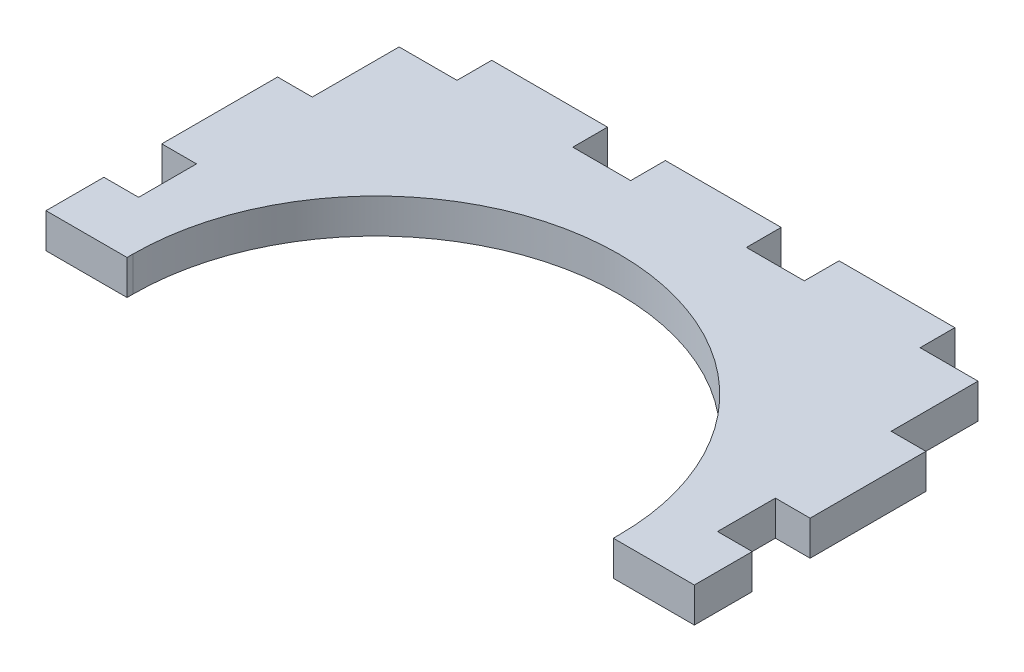
from build123d import *

# Parameters (mm, degrees)
EXTRUDE_1_DEPTH = 3


with BuildPart() as part:
    # 草图2 → 凸台-拉伸1 (new body)
    with BuildSketch(Plane(origin=(0, 0, 0), x_dir=(1, 0, 0), z_dir=(0, 1, 0))):
        with BuildLine():
            Line((-25, 27.5), (-20, 27.5))
            Line((-20, 27.5), (-20, 30.5))
            Line((-20, 30.5), (-10, 30.5))
            Line((-10, 30.5), (-10, 27.5))
            Line((-10, 27.5), (-5, 27.5))
            Line((-5, 27.5), (-5, 30.5))
            Line((-5, 30.5), (5, 30.5))
            Line((5, 30.5), (5, 27.5))
            Line((5, 27.5), (10, 27.5))
            Line((10, 27.5), (10, 30.5))
            Line((10, 30.5), (20, 30.5))
            Line((20, 30.5), (20, 27.5))
            Line((20, 27.5), (25, 27.5))
            Line((25, 27.5), (25, 20))
            Line((25, 20), (28, 20))
            Line((28, 20), (28, 10))
            Line((28, 10), (25, 10))
            Line((25, 10), (25, 5))
            Line((25, 5), (28, 5))
            Line((28, 5), (28, 0.5))
            Line((28, 0.5), (28, 0))
            Line((28, 0), (21, 0))
            Line((21, 0), (21, 0.5))
            ThreePointArc((21, 0.5), (0, 21.5), (-21, 0.5))
            Line((-21, 0.5), (-21, 0))
            Line((-21, 0), (-28, 0))
            Line((-28, 0), (-28, 0.5))
            Line((-28, 0.5), (-28, 5))
            Line((-28, 5), (-25, 5))
            Line((-25, 5), (-25, 10))
            Line((-25, 10), (-28, 10))
            Line((-28, 10), (-28, 20))
            Line((-28, 20), (-25, 20))
            Line((-25, 20), (-25, 27.5))
        make_face()
    extrude(amount=EXTRUDE_1_DEPTH)


solid = part.part
